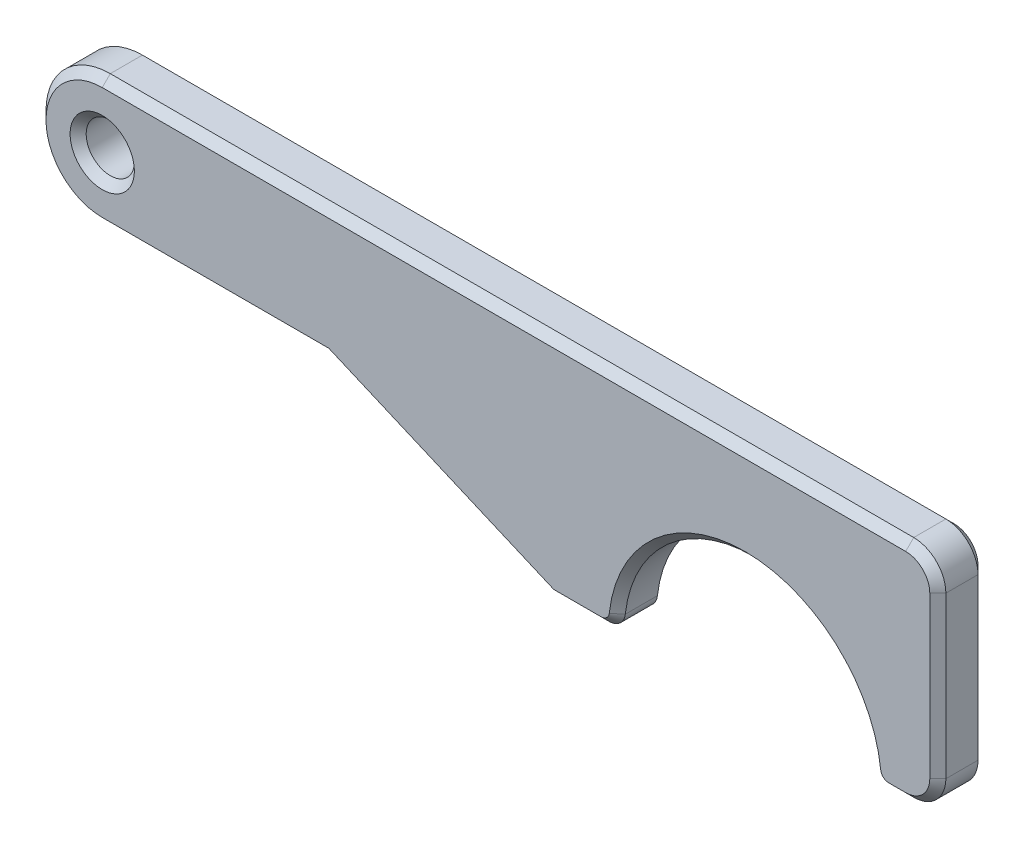
from build123d import *

# Parameters (mm, degrees)
SKETCH1_R           = 12.7
SKETCH1_R_2         = 4.7625
BOSS_EXTRUDE1_DEPTH = 9.525
FILLET1_R           = 6.35
FILLET2_R           = 3.175
CHAMFER1_SIZE       = 1.5875


with BuildPart() as part:
    # Sketch1 → Boss-Extrude1 (new body)
    # profile 1 of 2: a face of its own
    with BuildSketch(Plane.XY):
        with BuildLine():
            Line((165.1, 12.7), (0, 12.7))
            ThreePointArc((0, 12.7), (8.980256121, 8.980256121), (12.7, 0))
            ThreePointArc((12.7, 0), (8.980256121, -8.980256121), (0, -12.7))
            Line((0, -12.7), (44.45, -12.7))
            Line((44.45, -12.7), (88.9, -31.75))
            Line((88.9, -31.75), (101.6, -31.75))
            ThreePointArc((101.6, -31.75), (127, -6.35), (152.4, -31.75))
            Line((152.4, -31.75), (165.1, -31.75))
            Line((165.1, -31.75), (165.1, 12.7))
        make_face()
    # profile 2 of 2: a face of its own
    with BuildSketch(Plane.XY):
        Circle(SKETCH1_R)
        with Locations(Location((0, 0, 0), (0, 0, 180))):
            Circle(SKETCH1_R_2, mode=Mode.SUBTRACT)
    extrude(amount=BOSS_EXTRUDE1_DEPTH)

    # Fillet1
    fillet1_edges = [part.edges().sort_by_distance(p)[0] for p in [
        (165.1, 12.7, 4.7625),
        (165.1, -31.75, 4.7625),
    ]]
    fillet(fillet1_edges, radius=FILLET1_R)

    # Fillet2
    fillet2_edges = [part.edges().sort_by_distance(p)[0] for p in [
        (101.6, -31.75, 4.7625),
        (152.4, -31.75, 4.7625),
    ]]
    fillet(fillet2_edges, radius=FILLET2_R)

    # Chamfer1
    chamfer1_edges = [part.edges().sort_by_distance(p)[0] for p in [
        (93.750968343, -31.75, 0),
        (66.675, -22.225, 0),
        (22.225, -12.7, 0),
        (-12.7, 0, 0),
        (79.375, 12.7, 0),
        (79.375, 12.7, 9.525),
        (-12.7, 0, 9.525),
        (22.225, -12.7, 9.525),
        (66.675, -22.225, 9.525),
        (165.1, -9.525, 0),
        (165.1, -9.525, 9.525),
        (157.074031657, -31.75, 0),
        (163.240128061, 10.840128061, 0),
        (93.750968343, -31.75, 9.525),
        (163.240128061, -29.890128061, 0),
        (157.074031657, -31.75, 9.525),
        (163.240128061, 10.840128061, 9.525),
        (163.240128061, -29.890128061, 9.525),
        (4.7625, 0, 9.525),
        (127, -6.35, 0),
        (100.718603352, -30.941505276, 0),
        (153.281396648, -30.941505276, 0),
        (127, -6.35, 9.525),
        (100.718603352, -30.941505276, 9.525),
        (153.281396648, -30.941505276, 9.525),
        (4.7625, 0, 0),
    ]]
    chamfer(chamfer1_edges, length=CHAMFER1_SIZE)


solid = part.part
